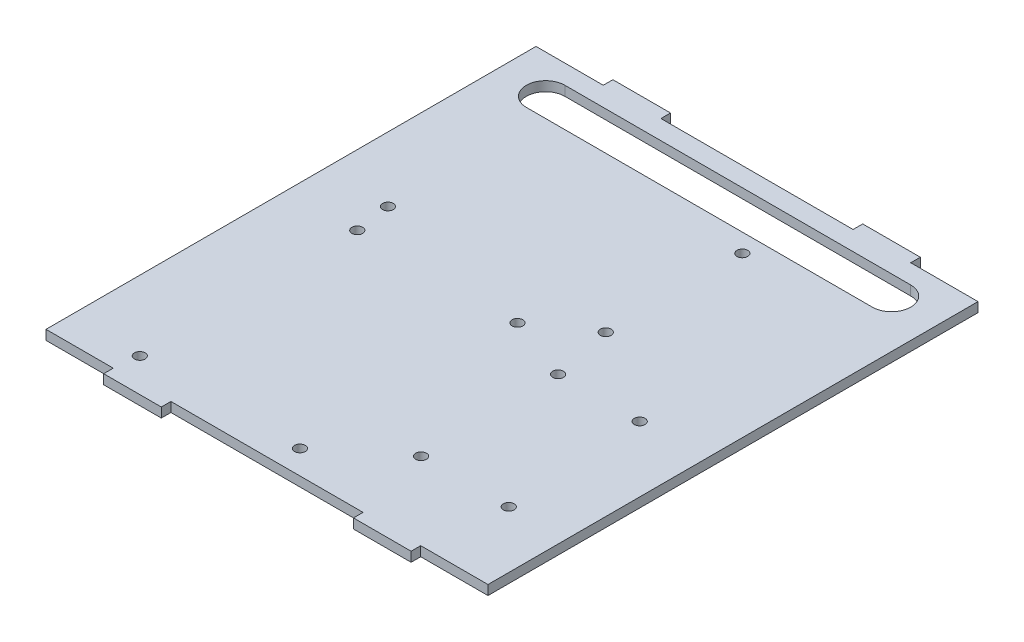
from build123d import *

# Parameters (mm, degrees)
SKETCH1_W           = 146.05
SKETCH1_H           = 161.925
BOSS_EXTRUDE1_DEPTH = 3.175
SKETCH2_W           = 19.05
SKETCH2_H           = 3.175
BOSS_EXTRUDE2_DEPTH = 3.175
CUT_EXTRUDE1_DEPTH  = 112.453354172
CUT_EXTRUDE2_REACH  = 113.453
SKETCH4_R           = 1.778


with BuildPart() as part:
    # Sketch1 → Boss-Extrude1 (new body)
    with BuildSketch(Plane(origin=(0, 0, 0), x_dir=(1, 0, 0), z_dir=(0, 1, 0))):
        Rectangle(SKETCH1_W, SKETCH1_H)
    extrude(amount=BOSS_EXTRUDE1_DEPTH)

    # Sketch2 → Boss-Extrude2 (add)
    with BuildSketch(Plane(origin=(0, 3.175, 0), x_dir=(1, 0, 0), z_dir=(0, 1, 0))):
        with Locations((-41.275, 82.55)):
            Rectangle(SKETCH2_W, SKETCH2_H)
        with Locations((41.275, 82.55)):
            Rectangle(SKETCH2_W, SKETCH2_H)
        with Locations((41.275, -82.55)):
            Rectangle(SKETCH2_W, SKETCH2_H)
        with Locations((-41.275, -82.55)):
            Rectangle(SKETCH2_W, SKETCH2_H)
    extrude(amount=-BOSS_EXTRUDE2_DEPTH)

    # Sketch3 → Cut-Extrude1 (cut, through all)
    with BuildSketch(Plane(origin=(0, 3.175, 0), x_dir=(1, 0, 0), z_dir=(0, 1, 0))):
        with BuildLine():
            Line((-57.15, 74.6125), (57.15, 74.6125))
            ThreePointArc((57.15, 74.6125), (63.5, 68.2625), (57.15, 61.9125))
            Line((57.15, 61.9125), (-57.15, 61.9125))
            ThreePointArc((-57.15, 61.9125), (-63.5, 68.2625), (-57.15, 74.6125))
        make_face()
    extrude(amount=-CUT_EXTRUDE1_DEPTH, mode=Mode.SUBTRACT)

    # Sketch4 → Cut-Extrude2 (cut, up to next)
    with BuildSketch(Plane(origin=(0, 3.175, 0), x_dir=(1, 0, 0), z_dir=(0, 1, 0)), mode=Mode.PRIVATE) as cut_extrude2_sk1:
        with Locations(Location((54.229, -55.3085, 0), (0, 0, 270))):
            Circle(SKETCH4_R)
    cut_extrude2_tool1 = extrude(cut_extrude2_sk1.sketch, amount=-CUT_EXTRUDE2_REACH, mode=Mode.PRIVATE) & part.part
    # Sketch4 → Cut-Extrude2 (cut, up to next)
    with BuildSketch(Plane(origin=(0, 3.175, 0), x_dir=(1, 0, 0), z_dir=(0, 1, 0)), mode=Mode.PRIVATE) as cut_extrude2_sk2:
        with Locations(Location((25.273, -55.3085, 0), (0, 0, 270))):
            Circle(SKETCH4_R)
    cut_extrude2_tool2 = extrude(cut_extrude2_sk2.sketch, amount=-CUT_EXTRUDE2_REACH, mode=Mode.PRIVATE) & part.part
    # Sketch4 → Cut-Extrude2 (cut, up to next)
    with BuildSketch(Plane(origin=(0, 3.175, 0), x_dir=(1, 0, 0), z_dir=(0, 1, 0)), mode=Mode.PRIVATE) as cut_extrude2_sk3:
        with Locations(Location((24.4602, -9.2329, 0), (0, 0, 270))):
            Circle(SKETCH4_R)
    cut_extrude2_tool3 = extrude(cut_extrude2_sk3.sketch, amount=-CUT_EXTRUDE2_REACH, mode=Mode.PRIVATE) & part.part
    # Sketch4 → Cut-Extrude2 (cut, up to next)
    with BuildSketch(Plane(origin=(0, 3.175, 0), x_dir=(1, 0, 0), z_dir=(0, 1, 0)), mode=Mode.PRIVATE) as cut_extrude2_sk4:
        with Locations(Location((51.435, -9.2329, 0), (0, 0, 270))):
            Circle(SKETCH4_R)
    cut_extrude2_tool4 = extrude(cut_extrude2_sk4.sketch, amount=-CUT_EXTRUDE2_REACH, mode=Mode.PRIVATE) & part.part
    # Sketch4 → Cut-Extrude2 (cut, up to next)
    with BuildSketch(Plane(origin=(0, 3.175, 0), x_dir=(1, 0, 0), z_dir=(0, 1, 0)), mode=Mode.PRIVATE) as cut_extrude2_sk5:
        with Locations(Location((3.0226, -73.0885, 0), (0, 0, 270))):
            Circle(SKETCH4_R)
    cut_extrude2_tool5 = extrude(cut_extrude2_sk5.sketch, amount=-CUT_EXTRUDE2_REACH, mode=Mode.PRIVATE) & part.part
    # Sketch4 → Cut-Extrude2 (cut, up to next)
    with BuildSketch(Plane(origin=(0, 3.175, 0), x_dir=(1, 0, 0), z_dir=(0, 1, 0)), mode=Mode.PRIVATE) as cut_extrude2_sk6:
        with Locations(Location((-49.911, -73.0885, 0), (0, 0, 270))):
            Circle(SKETCH4_R)
    cut_extrude2_tool6 = extrude(cut_extrude2_sk6.sketch, amount=-CUT_EXTRUDE2_REACH, mode=Mode.PRIVATE) & part.part
    # Sketch4 → Cut-Extrude2 (cut, up to next)
    with BuildSketch(Plane(origin=(0, 3.175, 0), x_dir=(1, 0, 0), z_dir=(0, 1, 0)), mode=Mode.PRIVATE) as cut_extrude2_sk7:
        with Locations(Location((-49.911, -1.2065, 0), (0, 0, 270))):
            Circle(SKETCH4_R)
    cut_extrude2_tool7 = extrude(cut_extrude2_sk7.sketch, amount=-CUT_EXTRUDE2_REACH, mode=Mode.PRIVATE) & part.part
    # Sketch4 → Cut-Extrude2 (cut, up to next)
    with BuildSketch(Plane(origin=(0, 3.175, 0), x_dir=(1, 0, 0), z_dir=(0, 1, 0)), mode=Mode.PRIVATE) as cut_extrude2_sk8:
        with Locations(Location((3.0226, -1.2065, 0), (0, 0, 270))):
            Circle(SKETCH4_R)
    cut_extrude2_tool8 = extrude(cut_extrude2_sk8.sketch, amount=-CUT_EXTRUDE2_REACH, mode=Mode.PRIVATE) & part.part
    # Sketch4 → Cut-Extrude2 (cut, up to next)
    with BuildSketch(Plane(origin=(0, 3.175, 0), x_dir=(1, 0, 0), z_dir=(0, 1, 0)), mode=Mode.PRIVATE) as cut_extrude2_sk9:
        with Locations(Location((-51.689, 10.6807, 0), (0, 0, 270))):
            Circle(SKETCH4_R)
    cut_extrude2_tool9 = extrude(cut_extrude2_sk9.sketch, amount=-CUT_EXTRUDE2_REACH, mode=Mode.PRIVATE) & part.part
    # Sketch4 → Cut-Extrude2 (cut, up to next)
    with BuildSketch(Plane(origin=(0, 3.175, 0), x_dir=(1, 0, 0), z_dir=(0, 1, 0)), mode=Mode.PRIVATE) as cut_extrude2_sk10:
        with Locations(Location((20.2946, 10.6807, 0), (0, 0, 270))):
            Circle(SKETCH4_R)
    cut_extrude2_tool10 = extrude(cut_extrude2_sk10.sketch, amount=-CUT_EXTRUDE2_REACH, mode=Mode.PRIVATE) & part.part
    # Sketch4 → Cut-Extrude2 (cut, up to next)
    with BuildSketch(Plane(origin=(0, 3.175, 0), x_dir=(1, 0, 0), z_dir=(0, 1, 0)), mode=Mode.PRIVATE) as cut_extrude2_sk11:
        with Locations(Location((20.2946, 55.8165, 0), (0, 0, 270))):
            Circle(SKETCH4_R)
    cut_extrude2_tool11 = extrude(cut_extrude2_sk11.sketch, amount=-CUT_EXTRUDE2_REACH, mode=Mode.PRIVATE) & part.part
    add(cut_extrude2_tool1.solids().sort_by_distance((54.229, 3.175, 55.3085))[0], mode=Mode.SUBTRACT)
    add(cut_extrude2_tool2.solids().sort_by_distance((25.273, 3.175, 55.3085))[0], mode=Mode.SUBTRACT)
    add(cut_extrude2_tool3.solids().sort_by_distance((24.4602, 3.175, 9.2329))[0], mode=Mode.SUBTRACT)
    add(cut_extrude2_tool4.solids().sort_by_distance((51.435, 3.175, 9.2329))[0], mode=Mode.SUBTRACT)
    add(cut_extrude2_tool5.solids().sort_by_distance((3.0226, 3.175, 73.0885))[0], mode=Mode.SUBTRACT)
    add(cut_extrude2_tool6.solids().sort_by_distance((-49.911, 3.175, 73.0885))[0], mode=Mode.SUBTRACT)
    add(cut_extrude2_tool7.solids().sort_by_distance((-49.911, 3.175, 1.2065))[0], mode=Mode.SUBTRACT)
    add(cut_extrude2_tool8.solids().sort_by_distance((3.0226, 3.175, 1.2065))[0], mode=Mode.SUBTRACT)
    add(cut_extrude2_tool9.solids().sort_by_distance((-51.689, 3.175, -10.6807))[0], mode=Mode.SUBTRACT)
    add(cut_extrude2_tool10.solids().sort_by_distance((20.2946, 3.175, -10.6807))[0], mode=Mode.SUBTRACT)
    add(cut_extrude2_tool11.solids().sort_by_distance((20.2946, 3.175, -55.8165))[0], mode=Mode.SUBTRACT)


solid = part.part
